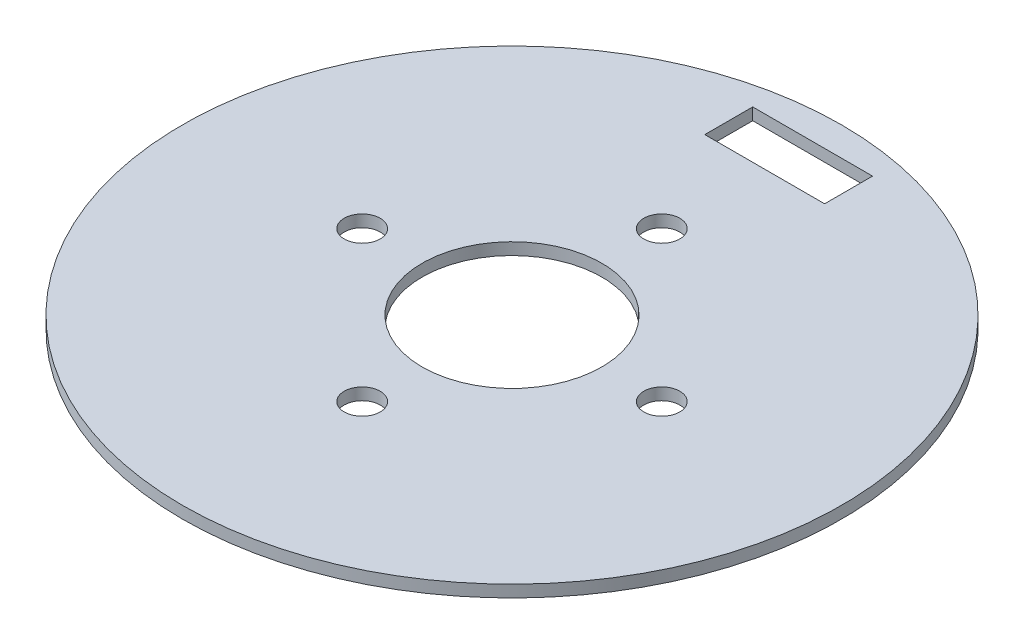
from build123d import *

# Parameters (mm, degrees)
SKETCH1_R           = 27.5
SKETCH1_R_2         = 1.5
SKETCH1_R_3         = 7.5
SKETCH1_W           = 10
SKETCH1_H           = 4
BOSS_EXTRUDE1_DEPTH = 1


with BuildPart() as part:
    # Sketch1 → Boss-Extrude1 (new body)
    with BuildSketch(Plane(origin=(0, 0, 0), x_dir=(1, 0, 0), z_dir=(0, 1, 0))):
        with Locations(Location((0, 0, 0), (0, 0, 270))):
            Circle(SKETCH1_R)
        with Locations(Location((0, 12.5, 0), (0, 0, 270))):
            Circle(SKETCH1_R_2, mode=Mode.SUBTRACT)
        with Locations(Location((12.5, 0, 0), (0, 0, 270))):
            Circle(SKETCH1_R_2, mode=Mode.SUBTRACT)
        with Locations(Location((0, -12.5, 0), (0, 0, 270))):
            Circle(SKETCH1_R_2, mode=Mode.SUBTRACT)
        with Locations(Location((-12.5, 0, 0), (0, 0, 270))):
            Circle(SKETCH1_R_2, mode=Mode.SUBTRACT)
        with Locations(Location((0, 0, 0), (0, 0, 270))):
            Circle(SKETCH1_R_3, mode=Mode.SUBTRACT)
        with Locations((0, 23.086362523)):
            Rectangle(SKETCH1_W, SKETCH1_H, mode=Mode.SUBTRACT)
    extrude(amount=BOSS_EXTRUDE1_DEPTH)


solid = part.part
